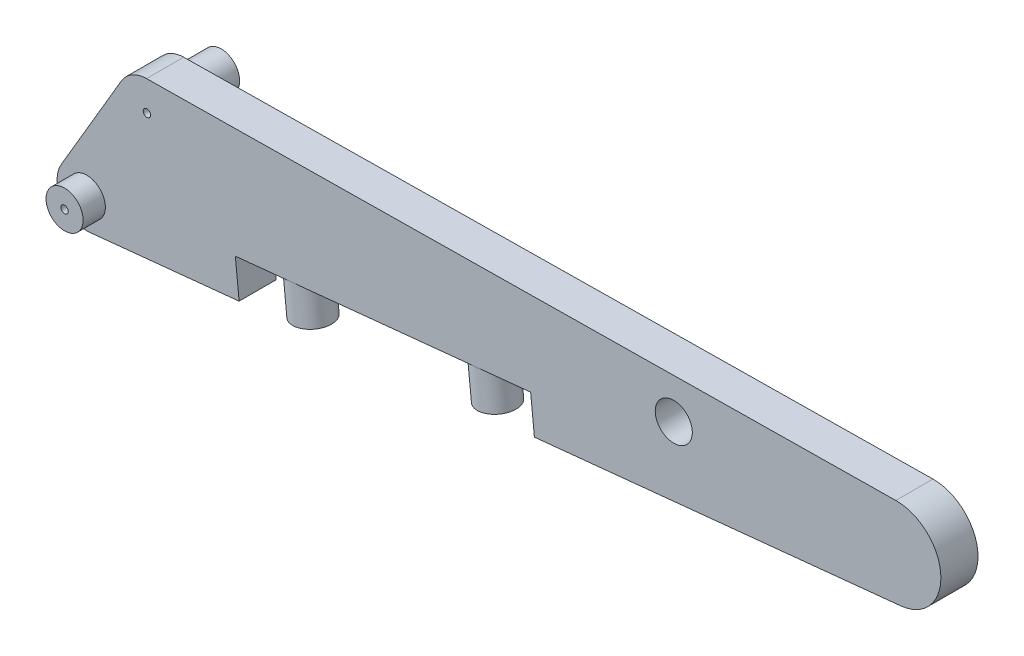
from build123d import *

# Parameters (mm, degrees)
SKETCH3_R           = 2.5
BOSS_EXTRUDE1_DEPTH = 5
BOSS_EXTRUDE2_START = -10
SKETCH4_R           = 2.5
SKETCH4_R_2         = 0.5
BOSS_EXTRUDE2_DEPTH = 10
SKETCH5_R           = 2.5
SKETCH5_R_2         = 0.5
BOSS_EXTRUDE3_DEPTH = 8
SKETCH6_R           = 2.5
CUT_EXTRUDE1_DEPTH  = 5
CUT_EXTRUDE2_DEPTH  = 5
SKETCH8_R           = 2.5
SKETCH8_R_2         = 0.5
BOSS_EXTRUDE4_DEPTH = 5


with BuildPart() as part:
    # Sketch3 → Boss-Extrude1 (new body)
    with BuildSketch(Plane.XY):
        with BuildLine():
            Line((-11.551452097, -11.771319146), (-3.449219334, 2.025558191))
            ThreePointArc((-3.449219334, 2.025558191), (-2.00867995, 3.459075723), (-0.049634206, 3.999692044))
            Line((-0.049634206, 3.999692044), (100.92554869, 5.252744283))
            ThreePointArc((100.92554869, 5.252744283), (106.990382731, -0.40721355), (101.604045304, -6.716310453))
            Line((101.604045304, -6.716310453), (-7.699535894, -17.776555117))
            ThreePointArc((-7.699535894, -17.776555117), (-11.469136318, -15.956497778), (-11.551452097, -11.771319146))
        make_face()
        with Locations((-8.102232763, -13.796877337)):
            Circle(SKETCH3_R, mode=Mode.SUBTRACT)
        Circle(SKETCH3_R, mode=Mode.SUBTRACT)
    extrude(amount=BOSS_EXTRUDE1_DEPTH)

    # Sketch4 → Boss-Extrude2 (add)
    with BuildSketch(Plane.XY.offset(5).offset(BOSS_EXTRUDE2_START)):
        Circle(SKETCH4_R)
        Circle(SKETCH4_R_2, mode=Mode.SUBTRACT)
    extrude(amount=BOSS_EXTRUDE2_DEPTH)

    # Sketch5 → Boss-Extrude3 (add)
    with BuildSketch(Plane(origin=(0, 0, 0), x_dir=(-1, 0, 0), z_dir=(0, 0, -1))):
        with Locations((8.102232763, -13.796877337)):
            Circle(SKETCH5_R)
        with Locations((8.102232763, -13.796877337)):
            Circle(SKETCH5_R_2, mode=Mode.SUBTRACT)
    extrude(amount=-BOSS_EXTRUDE3_DEPTH)

    # Sketch6 → Cut-Extrude1 (cut)
    with BuildSketch(Plane(origin=(0, 0, 0), x_dir=(-1, 0, 0), z_dir=(0, 0, -1))):
        with Locations((-71, -0.524973847)):
            Circle(SKETCH6_R)
    extrude(amount=-CUT_EXTRUDE1_DEPTH, mode=Mode.SUBTRACT)

    # Sketch7 → Cut-Extrude2 (cut)
    with BuildSketch(Plane(origin=(0, 0, 0), x_dir=(-1, 0, 0), z_dir=(0, 0, -1))):
        Polygon((-52.217542839, -11.713647177), (-12.42076504, -15.740615868), (-11.91482349, -10.740615868), (-51.711601289, -6.713647177), align=None)
    extrude(amount=-CUT_EXTRUDE2_DEPTH, mode=Mode.SUBTRACT)

    # Sketch8 → Boss-Extrude4 (add)
    # profile 1 of 2: a face of its own
    with BuildSketch(Plane(origin=(1.196569763, -11.825177849, 0), x_dir=(0.9949194449683489, 0.10067421727469462, 0), z_dir=(0.10067421727469462, -0.9949194449683489, 0))):
        with Locations(Location((18.272986478, 2.5, 0), (0, 0, 270))):
            Circle(SKETCH8_R)
        with Locations((18.272986478, 2.5)):
            Circle(SKETCH8_R_2, mode=Mode.SUBTRACT)
    # profile 2 of 2: a face of its own
    with BuildSketch(Plane(origin=(1.196569763, -11.825177849, 0), x_dir=(0.9949194449683489, 0.10067421727469462, 0), z_dir=(0.10067421727469462, -0.9949194449683489, 0))):
        with Locations(Location((43.272986478, 2.5, 0), (0, 0, 270))):
            Circle(SKETCH8_R)
        with Locations((43.272986478, 2.5)):
            Circle(SKETCH8_R_2, mode=Mode.SUBTRACT)
    extrude(amount=BOSS_EXTRUDE4_DEPTH)


solid = part.part
